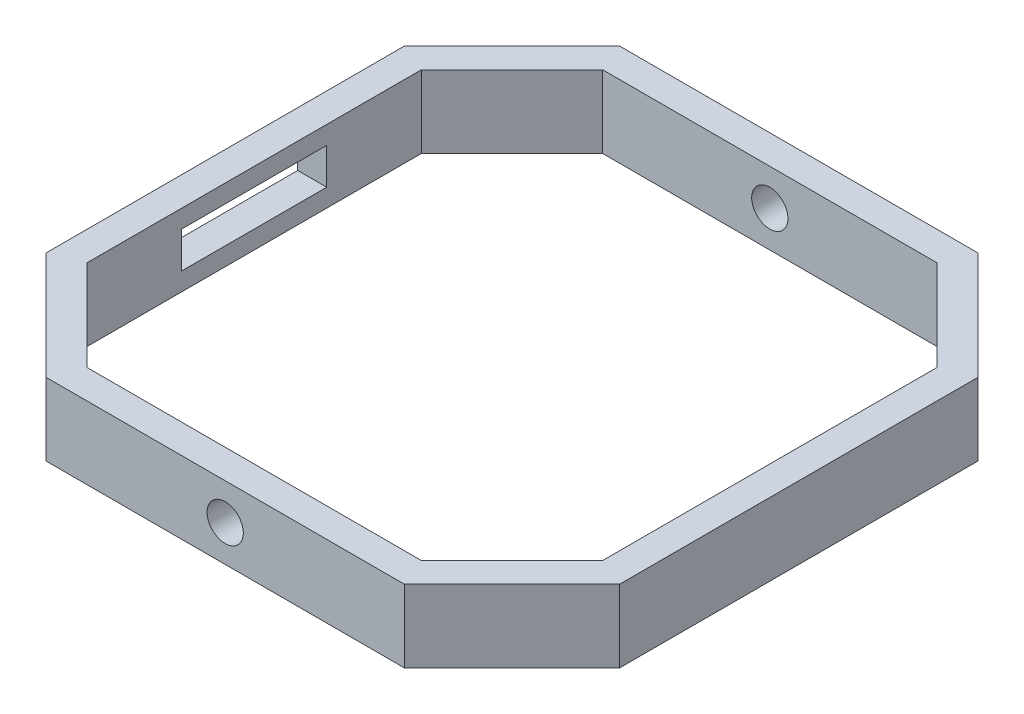
from build123d import *

# Parameters (mm, degrees)
BOSS_EXTRUDE1_DEPTH     = 5
CUT_EXTRUDE2_START      = -75.1
SKETCH3_W               = 20
SKETCH3_H               = 5
CUT_EXTRUDE2_DEPTH      = 14.477720111
CUT_EXTRUDE3_DEPTH      = 89.577720111
CUT_EXTRUDE3_DEPTH_BACK = 89.577720111
SKETCH4_R               = 2.5


with BuildPart() as part:
    # Sketch1 → Boss-Extrude1 (new, symmetric)
    with BuildSketch(Plane(origin=(0, 0, 0), x_dir=(1, 0, 0), z_dir=(0, 1, 0))):
        Polygon((-24.706854249, 39.55), (24.706854249, 39.55), (39.55, 24.706854249), (39.55, -24.706854249), (24.706854249, -39.55), (-24.706854249, -39.55), (-39.55, -24.706854249), (-39.55, 24.706854249), align=None)
        Polygon((-35.55, 23.05), (-23.05, 35.55), (23.05, 35.55), (35.55, 23.05), (35.55, -23.05), (23.05, -35.55), (-23.05, -35.55), (-35.55, -23.05), align=None, mode=Mode.SUBTRACT)
    extrude(amount=BOSS_EXTRUDE1_DEPTH, both=True)

    # Sketch3 → Cut-Extrude2 (cut, through all)
    with BuildSketch(Plane(origin=(39.55, 0, 0), x_dir=(0, 0, -1), z_dir=(1, 0, 0)).offset(CUT_EXTRUDE2_START)):
        Rectangle(SKETCH3_W, SKETCH3_H)
    extrude(amount=-CUT_EXTRUDE2_DEPTH, mode=Mode.SUBTRACT)

    # Sketch4 → Cut-Extrude3 (cut, two sides: drawn at the far end of the back side and taken through both)
    with BuildSketch(Plane(origin=(0, 0, -39.55), x_dir=(-1, 0, 0), z_dir=(0, 0, -1)).offset(-CUT_EXTRUDE3_DEPTH_BACK)):
        with Locations(Location((0, 0, 0), (0, 0, 180))):
            Circle(SKETCH4_R)
    extrude(amount=CUT_EXTRUDE3_DEPTH + CUT_EXTRUDE3_DEPTH_BACK, mode=Mode.SUBTRACT)


solid = part.part
